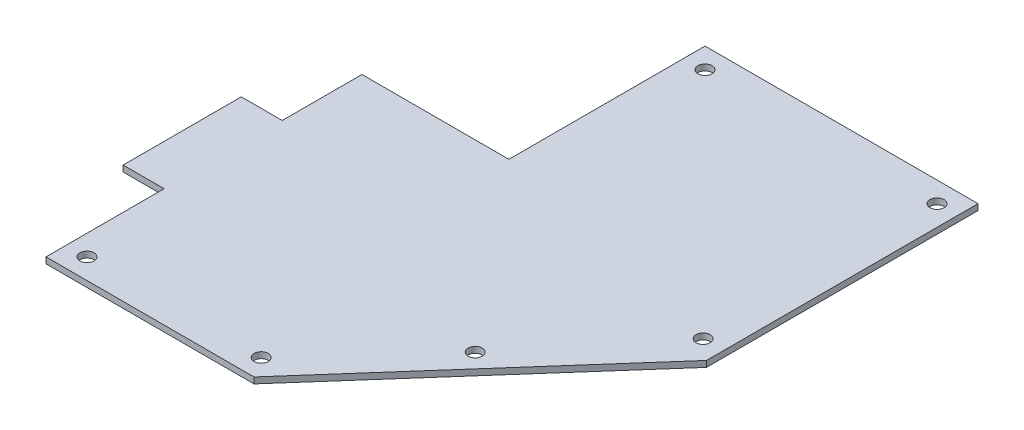
from build123d import *

# Parameters (mm, degrees)
BOSS_EXTRUDE1_DEPTH   = 1.5
F_4_0MM_DOWEL_HOLE1_D = 3.5


with BuildPart() as part:
    # Sketch1 → Boss-Extrude1 (new body)
    with BuildSketch(Plane(origin=(0, 0, 0), x_dir=(1, 0, 0), z_dir=(0, 1, 0))):
        Polygon((0, 0), (-67.7, 0), (-67.7, -48.64), (-104.14, -48.64), (-104.14, -68.409681711), (-114.3, -68.409681711), (-114.300084457, -97.709681711), (-104.140084457, -97.709681711), (-104.140084457, -126.999681711), (-52.560084457, -126.999681711), (0, -67.34), align=None)
    extrude(amount=BOSS_EXTRUDE1_DEPTH)

    # Ø4.0mm Dowel Hole1 (through all)
    with Locations(Plane(origin=(-99.060084457, 1.5, 121.919681711), x_dir=(0, 0, 1), z_dir=(0, 1, 0))):
        with Locations((0, 0), (0, 43.21), (-58.839681711, 93.980084457), (-27.682634748, 68.593581655), (-116.839681711, 93.980084457), (-116.839681711, 36.440084457)):
            Hole(F_4_0MM_DOWEL_HOLE1_D / 2)


solid = part.part
